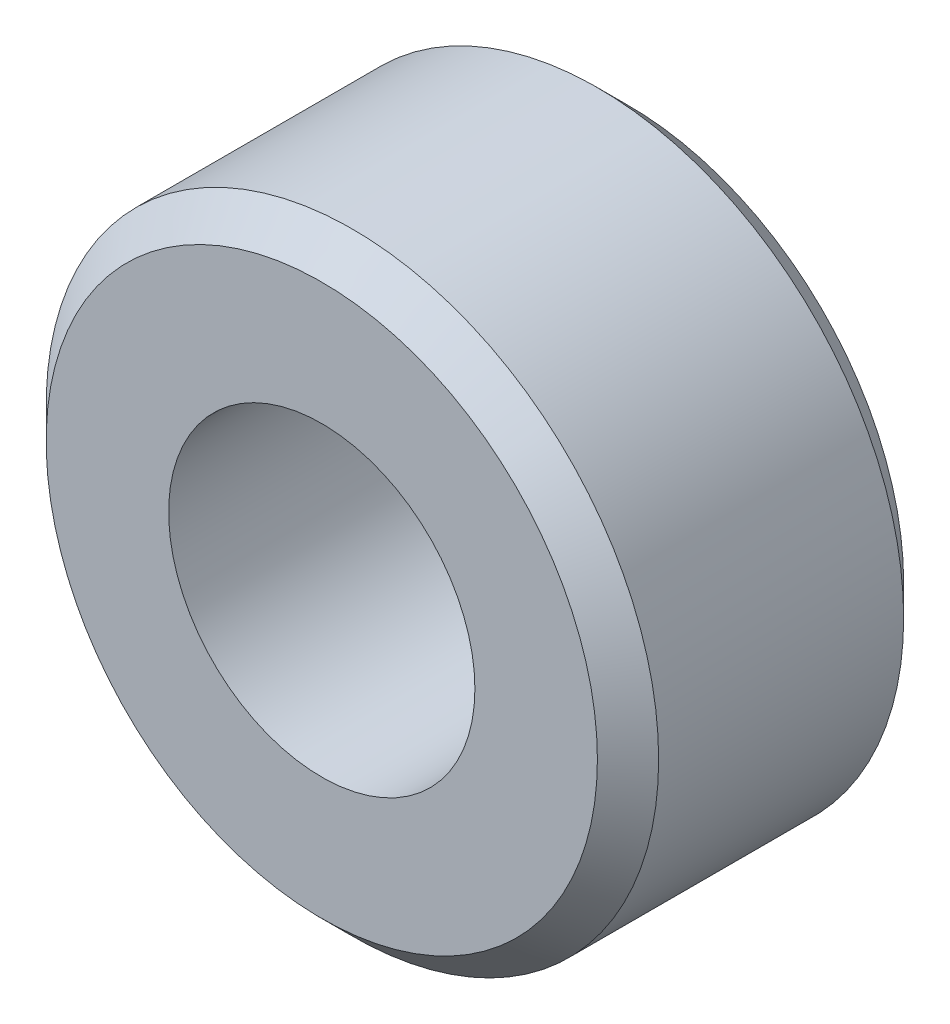
from build123d import *

# Parameters (mm, degrees)
SKETCH1_R           = 10
SKETCH1_R_2         = 5
BOSS_EXTRUDE1_DEPTH = 10
CHAMFER1_SIZE       = 1


with BuildPart() as part:
    # Sketch1 → Boss-Extrude1 (new body)
    with BuildSketch(Plane.XY):
        Circle(SKETCH1_R)
        Circle(SKETCH1_R_2, mode=Mode.SUBTRACT)
    extrude(amount=BOSS_EXTRUDE1_DEPTH)

    # Chamfer1
    chamfer1_edges = [part.edges().sort_by_distance(p)[0] for p in [
        (-10, 0, 0),
        (-10, 0, 10),
    ]]
    chamfer(chamfer1_edges, length=CHAMFER1_SIZE)


solid = part.part
